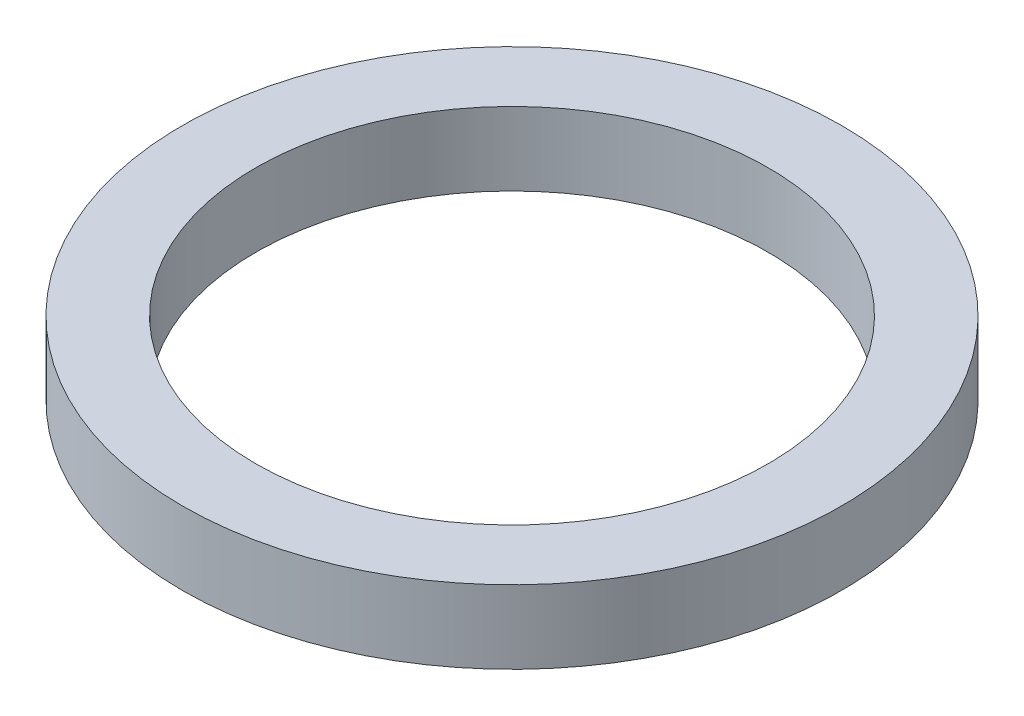
from build123d import *

# Parameters (mm, degrees)
SKETCH_1_R      = 45
SKETCH_1_R_2    = 35
EXTRUDE_1_DEPTH = 10


with BuildPart() as part:
    # 草图1 → 凸台-拉伸1 (new body)
    with BuildSketch(Plane(origin=(0, 0, 0), x_dir=(1, 0, 0), z_dir=(0, 1, 0))):
        with Locations(Location((0, 0, 0), (0, 0, 270))):
            Circle(SKETCH_1_R)
        with Locations(Location((0, 0, 0), (0, 0, 270))):
            Circle(SKETCH_1_R_2, mode=Mode.SUBTRACT)
    extrude(amount=EXTRUDE_1_DEPTH)


solid = part.part
